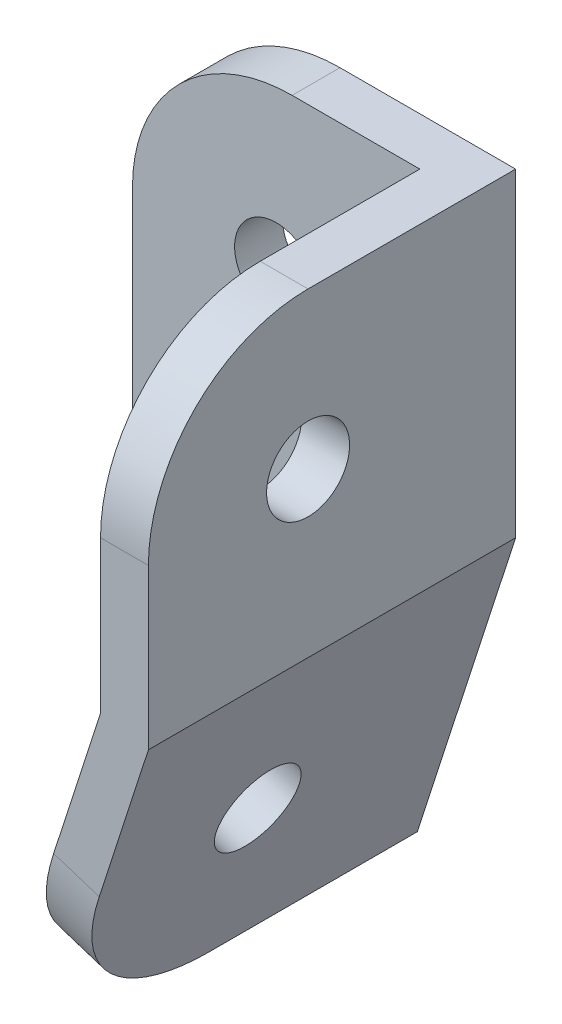
from build123d import *

# Parameters (mm, degrees)
BOSS_EXTRU_1_DEPTH      = 23
BOSS_EXTRU_2_DEPTH      = 3
ENL_V_MAT_EXTRU_1_DEPTH = 3
ESQUISSE4_R             = 2.6
ENL_V_MAT_EXTRU_2_DEPTH = 3
ESQUISSE5_R             = 2.6
ENL_V_MAT_EXTRU_3_DEPTH = 3
ESQUISSE6_R             = 2.6
ENL_V_MAT_EXTRU_4_DEPTH = 3
CONG_1_R                = 10


with BuildPart() as part:
    # Esquisse1 → Boss.-Extru.1 (new body)
    with BuildSketch(Plane.XY):
        Polygon((100, 92.65), (100, 112.65), (97, 112.65), (97, 93.123594611), (90.984838829, 74.546771861), (93.838946748, 73.622613873), align=None)
    extrude(amount=BOSS_EXTRU_1_DEPTH)

    # Esquisse2 → Boss.-Extru.2 (add)
    with BuildSketch(Plane.XY):
        Polygon((90.984838829, 74.546771861), (79, 74.546771861), (79, 112.65), (97, 112.65), (97, 93.123594611), align=None)
    extrude(amount=BOSS_EXTRU_2_DEPTH)

    # Esquisse3 → Enlèv. mat.-Extru.1 (cut)
    with BuildSketch(Plane.XY.offset(3)):
        Polygon((90.984838829, 74.546771861), (79, 78.427453619), (79, 74.546771861), align=None)
    extrude(amount=-ENL_V_MAT_EXTRU_1_DEPTH, mode=Mode.SUBTRACT)

    # Esquisse4 → Enlèv. mat.-Extru.2 (cut)
    with BuildSketch(Plane.XY.offset(3)):
        with Locations((88, 102.65)):
            Circle(ESQUISSE4_R)
        with Locations((88, 82.65)):
            Circle(ESQUISSE4_R)
    extrude(amount=-ENL_V_MAT_EXTRU_2_DEPTH, mode=Mode.SUBTRACT)

    # Esquisse5 → Enlèv. mat.-Extru.3 (cut)
    with BuildSketch(Plane.ZY.offset(-97)):
        with Locations((13, 102.886797306)):
            Circle(ESQUISSE5_R)
    extrude(amount=-ENL_V_MAT_EXTRU_3_DEPTH, mode=Mode.SUBTRACT)

    # Esquisse6 → Enlèv. mat.-Extru.4 (cut)
    with BuildSketch(Plane(origin=(60.503141075, -19.590871368, 0), x_dir=(0, 0, 1), z_dir=(-0.9513693063481516, 0.30805266260598485, 0))):
        with Locations(Location((13, 108.712835188, 0), (0, 0, 270))):
            Circle(ESQUISSE6_R)
    extrude(amount=-ENL_V_MAT_EXTRU_4_DEPTH, mode=Mode.SUBTRACT)

    # Congé1
    cong_1_edges = [part.edges().sort_by_distance(p)[0] for p in [
        (98.5, 112.65, 23),
        (92.411892788, 74.084692867, 23),
        (79, 112.65, 1.5),
        (79, 78.427453619, 1.5),
    ]]
    fillet(cong_1_edges, radius=CONG_1_R)


solid = part.part
